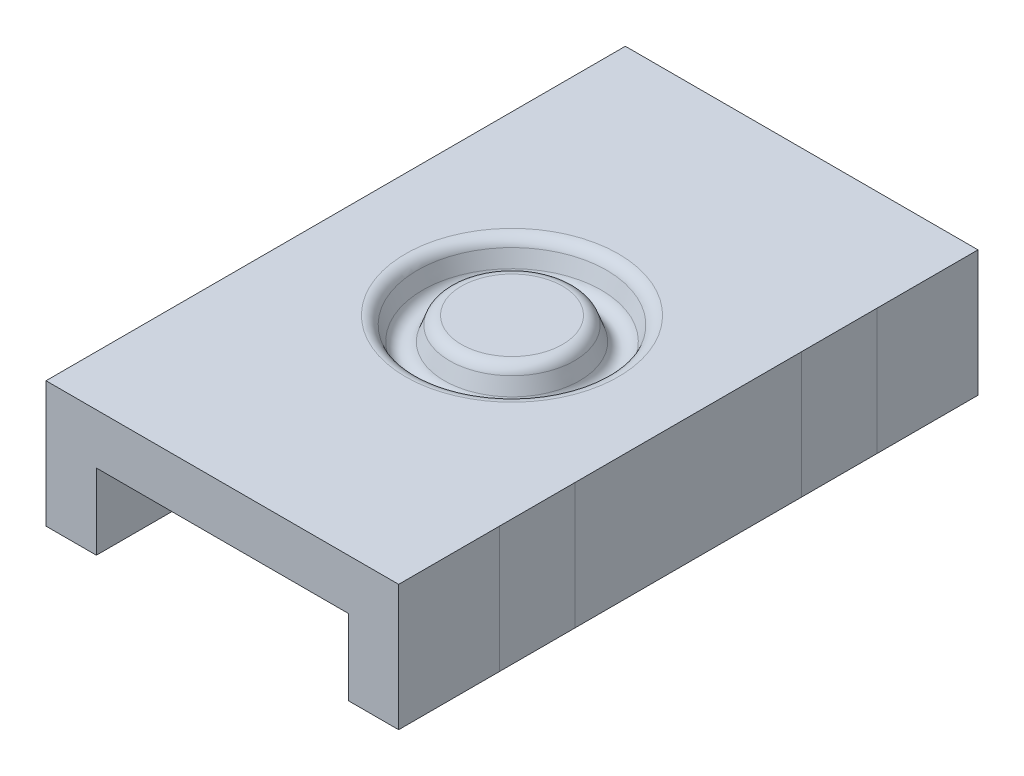
from build123d import *

# Parameters (mm, degrees)
SKETCH1_W           = 28
SKETCH1_H           = 46
BOSS_EXTRUDE1_DEPTH = 10
SKETCH2_W           = 20
SKETCH2_H           = 6
CUT_EXTRUDE1_DEPTH  = 50.112116631
FILLET3_R           = 1


with BuildPart() as part:
    # Sketch1 → Boss-Extrude1 (new body)
    with BuildSketch(Plane(origin=(0, 0, 0), x_dir=(1, 0, 0), z_dir=(0, 1, 0))):
        Rectangle(SKETCH1_W, SKETCH1_H)
    extrude(amount=BOSS_EXTRUDE1_DEPTH)

    # Sketch2 → Cut-Extrude1 (cut, through all)
    with BuildSketch(Plane.XY.offset(23)):
        with Locations((0, 3)):
            Rectangle(SKETCH2_W, SKETCH2_H)
    extrude(amount=-CUT_EXTRUDE1_DEPTH, mode=Mode.SUBTRACT)

    # Sketch3 → Cut-Revolve1 (revolve, cut)
    with BuildSketch(Plane.XY, mode=Mode.PRIVATE) as cut_revolve1_sk:
        with BuildLine():
            Line((5.375181252, 8.187051569), (4.715321987, 10))
            Line((4.715321987, 10), (7.754678013, 10))
            Line((7.754678013, 10), (7.094818748, 8.187051569))
            ThreePointArc((7.094818748, 8.187051569), (6.235, 7.585), (5.375181252, 8.187051569))
        make_face()
    revolve(cut_revolve1_sk.sketch.rotate(Axis((0, -1000.11801834, 0), (0, 1, 0)), 90), axis=Axis((0, -1000.11801834, 0), (0, 1, 0)), mode=Mode.SUBTRACT)

    # Fillet3
    fillet3_edges = [part.edges().sort_by_distance(p)[0] for p in [
        (0, 10, 7.754678013),
        (0, 10, 4.715321987),
    ]]
    fillet(fillet3_edges, radius=FILLET3_R)


solid = part.part
